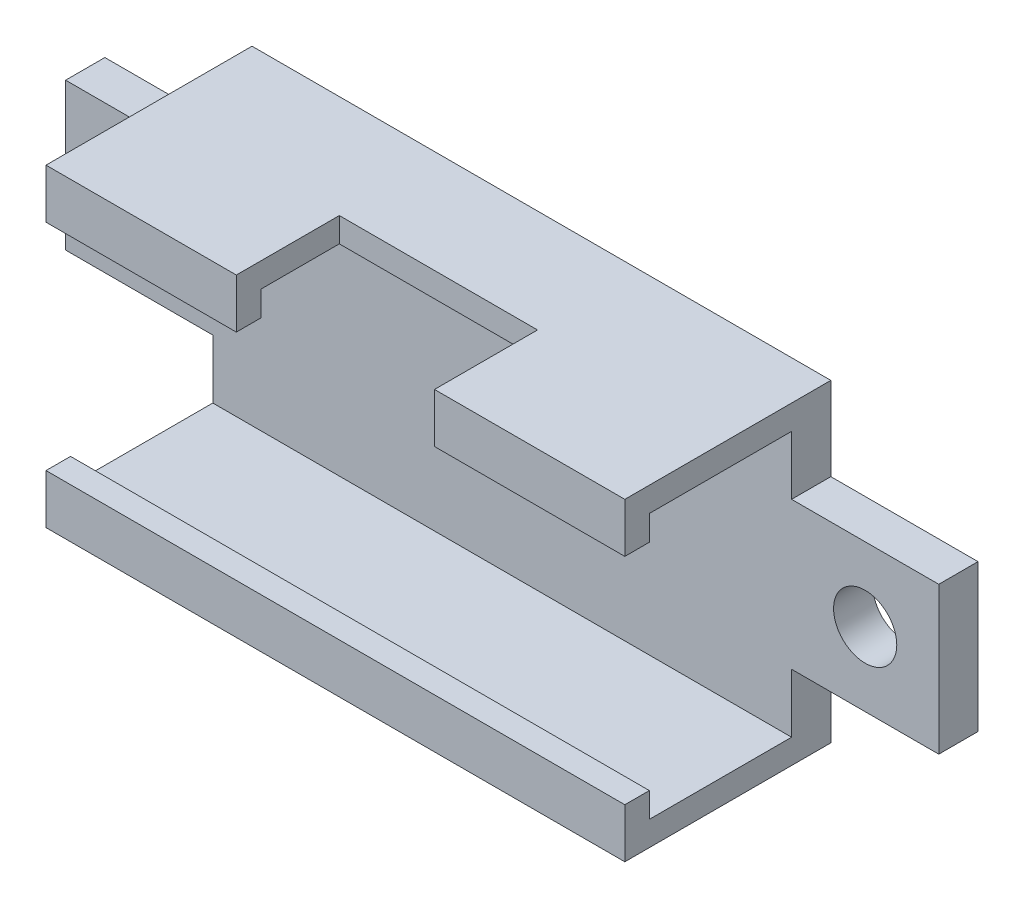
from build123d import *

# Parameters (mm, degrees)
BOSS_EXTRUDE2_DEPTH = 2
SKETCH3_R           = 1.61
CUT_EXTRUDE1_DEPTH  = 7.62
SKETCH6_W           = 29.5
SKETCH6_H           = 1.25
BOSS_EXTRUDE4_DEPTH = 8.5
SKETCH7_W           = 29.5
SKETCH7_H           = 1.25
BOSS_EXTRUDE5_DEPTH = 1.27
SKETCH10_W          = 10.1
SKETCH10_H          = 5.25
CUT_EXTRUDE2_DEPTH  = 2


with BuildPart() as part:
    # Sketch2 → Boss-Extrude2 (new body)
    with BuildSketch(Plane.XY):
        Polygon((0, 4.25), (0, 0), (29.5, 0), (29.5, 4.25), (37, 4.25), (37, 11.75), (29.5, 11.75), (29.5, 16), (0, 16), (0, 11.75), (-7.5, 11.75), (-7.5, 4.25), align=None)
    extrude(amount=-BOSS_EXTRUDE2_DEPTH)

    # Sketch3 → Cut-Extrude1 (cut)
    with BuildSketch(Plane.XY):
        with Locations((33.25, 8)):
            Circle(SKETCH3_R)
        with Locations((-3.75, 8)):
            Circle(SKETCH3_R)
    extrude(amount=-CUT_EXTRUDE1_DEPTH, mode=Mode.SUBTRACT)

    # Sketch6 → Boss-Extrude4 (add)
    with BuildSketch(Plane.XY):
        with Locations((14.75, 0.625)):
            Rectangle(SKETCH6_W, SKETCH6_H)
        with Locations((14.75, 15.375)):
            Rectangle(SKETCH6_W, SKETCH6_H)
    extrude(amount=BOSS_EXTRUDE4_DEPTH)

    # Sketch7 → Boss-Extrude5 (add)
    with BuildSketch(Plane.XZ.offset(-14.75)):
        with Locations((14.75, 7.875)):
            Rectangle(SKETCH7_W, SKETCH7_H)
    boss_extrude5 = extrude(amount=BOSS_EXTRUDE5_DEPTH)

    # Mirror1: Boss-Extrude5 across plane
    add(boss_extrude5.mirror(Plane.ZX.offset(8)))

    # Sketch10 → Cut-Extrude2 (cut, symmetric)
    with BuildSketch(Plane.XZ.offset(-14.75)):
        with Locations((14.75, 5.875)):
            Rectangle(SKETCH10_W, SKETCH10_H)
    extrude(amount=CUT_EXTRUDE2_DEPTH, both=True, mode=Mode.SUBTRACT)


solid = part.part
